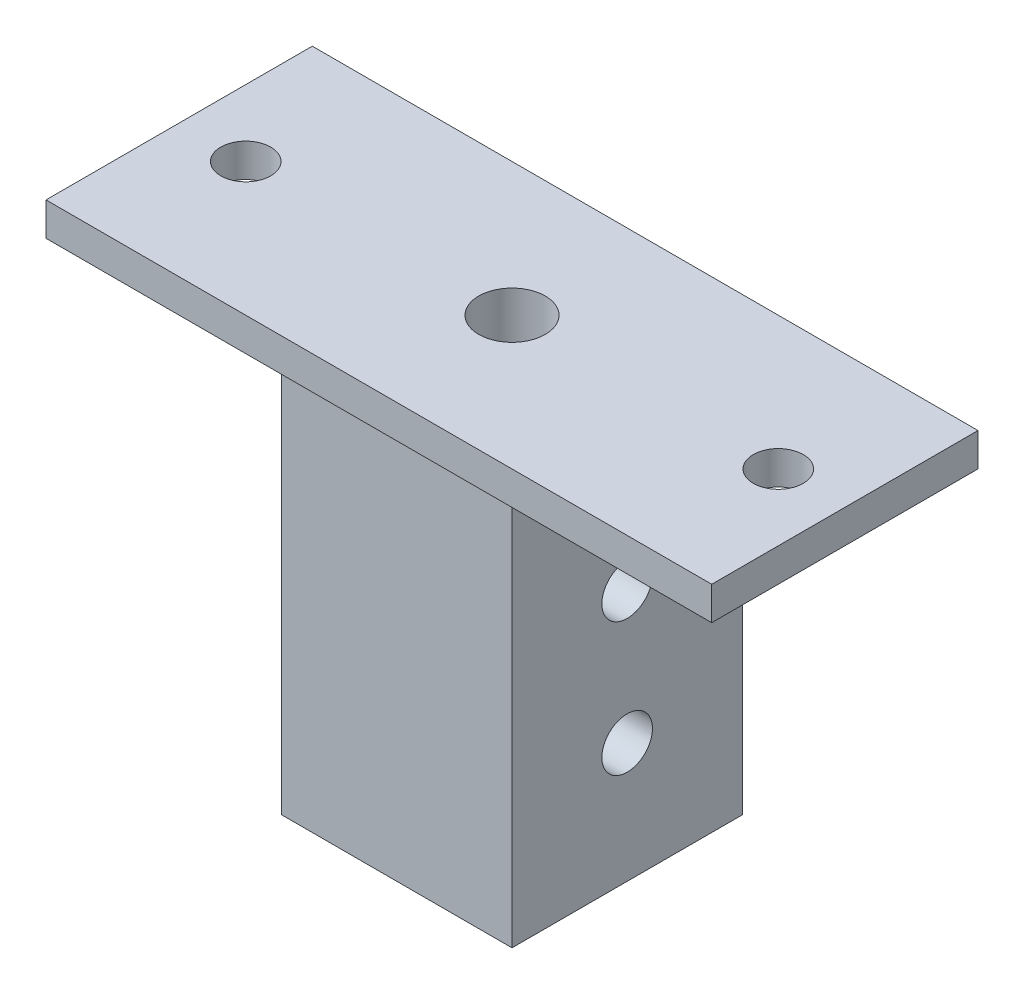
from build123d import *

# Parameters (mm, degrees)
SKETCH1_W           = 21.971
SKETCH1_H           = 21.971
BOSS_EXTRUDE1_DEPTH = 38.1
SKETCH2_W           = 63.5
SKETCH2_H           = 25.4
BOSS_EXTRUDE2_DEPTH = 3.175
SKETCH3_R           = 2.38125
CUT_EXTRUDE1_DEPTH  = 3.175
FILLET1_R           = 1.27
SKETCH4_R           = 3.175
CUT_EXTRUDE2_DEPTH  = 15.24
SKETCH5_R           = 2.413
CUT_EXTRUDE3_DEPTH  = 25.4


with BuildPart() as part:
    # Sketch1 → Boss-Extrude1 (new body)
    with BuildSketch(Plane(origin=(0, 0, 0), x_dir=(1, 0, 0), z_dir=(0, 1, 0))):
        Rectangle(SKETCH1_W, SKETCH1_H)
    extrude(amount=BOSS_EXTRUDE1_DEPTH)

    # Sketch2 → Boss-Extrude2 (add)
    with BuildSketch(Plane(origin=(0, 38.1, 0), x_dir=(1, 0, 0), z_dir=(0, 1, 0))):
        Rectangle(SKETCH2_W, SKETCH2_H)
    extrude(amount=BOSS_EXTRUDE2_DEPTH)

    # Sketch3 → Cut-Extrude1 (cut)
    with BuildSketch(Plane(origin=(0, 41.275, 0), x_dir=(1, 0, 0), z_dir=(0, 1, 0))):
        with Locations(Location((25.4, 0, 0), (0, 0, 270))):
            Circle(SKETCH3_R)
        with Locations(Location((-25.4, 0, 0), (0, 0, 270))):
            Circle(SKETCH3_R)
    extrude(amount=-CUT_EXTRUDE1_DEPTH, mode=Mode.SUBTRACT)

    # Fillet1
    fillet1_edges = [part.edges().sort_by_distance(p)[0] for p in [
        (-10.9855, 38.1, 0),
        (0, 38.1, 10.9855),
        (10.9855, 38.1, 0),
        (0, 38.1, -10.9855),
    ]]
    fillet(fillet1_edges, radius=FILLET1_R)

    # Sketch4 → Cut-Extrude2 (cut)
    with BuildSketch(Plane(origin=(0, 41.275, 0), x_dir=(1, 0, 0), z_dir=(0, 1, 0))):
        with Locations(Location((0, 0, 0), (0, 0, 270))):
            Circle(SKETCH4_R)
    extrude(amount=-CUT_EXTRUDE2_DEPTH, mode=Mode.SUBTRACT)

    # Sketch5 → Cut-Extrude3 (cut)
    with BuildSketch(Plane(origin=(10.9855, 0, 0), x_dir=(0, 0, -1), z_dir=(1, 0, 0))):
        with Locations((0, 24.13)):
            Circle(SKETCH5_R)
        with Locations((0, 11.43)):
            Circle(SKETCH5_R)
    extrude(amount=-CUT_EXTRUDE3_DEPTH, mode=Mode.SUBTRACT)


solid = part.part
